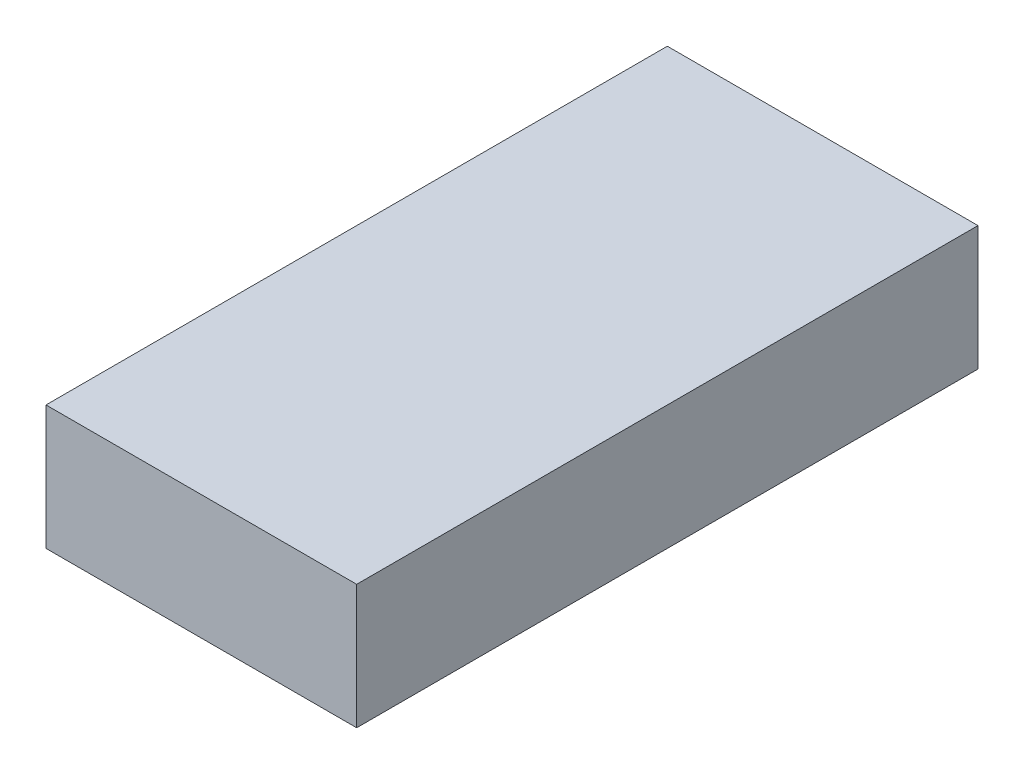
from build123d import *

# Parameters (mm, degrees)
SKETCH_1_W      = 25
SKETCH_1_H      = 50
EXTRUDE_1_DEPTH = 10


with BuildPart() as part:
    # 草图1 → 凸台-拉伸1 (new body)
    with BuildSketch(Plane(origin=(0, 0, 0), x_dir=(1, 0, 0), z_dir=(0, 1, 0))):
        Rectangle(SKETCH_1_W, SKETCH_1_H)
    extrude(amount=EXTRUDE_1_DEPTH)


solid = part.part
